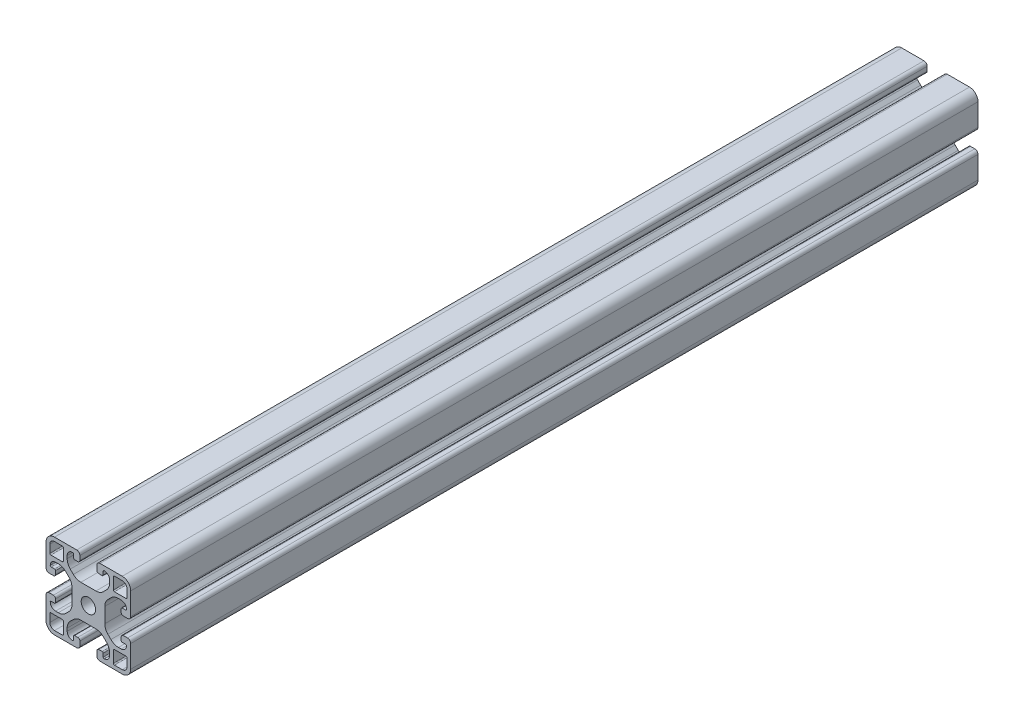
from build123d import *

# Parameters (mm, degrees)
ESQUISSE1_R        = 3.4
BOSS_EXTRU_1_DEPTH = 400


with BuildPart() as part:
    # Esquisse1 → Boss.-Extru.1 (new body)
    with BuildSketch(Plane(origin=(0, 0, -30), x_dir=(-1, 0, 0), z_dir=(0, 0, -1))):
        with BuildLine():
            Line((-4.5, 15), (-4.5, 13.5))
            ThreePointArc((-4.5, 13.5), (-4.353553391, 13.146446609), (-4, 13))
            Line((-4, 13), (-2.5, 13))
            ThreePointArc((-2.5, 13), (-2.146446609, 12.853553391), (-2, 12.5))
            ThreePointArc((-2, 12.5), (-2.732233047, 10.732233047), (-4.5, 10))
            Line((-4.5, 10), (-5.807611845, 10))
            ThreePointArc((-5.807611845, 10), (-7.721029006, 10.380602337), (-9.343145751, 11.464466094))
            Line((-9.343145751, 11.464466094), (-10.785533906, 12.906854249))
            ThreePointArc((-10.785533906, 12.906854249), (-11.869397663, 14.528970994), (-12.25, 16.442388155))
            Line((-12.25, 16.442388155), (-12.25, 23.557611845))
            ThreePointArc((-12.25, 23.557611845), (-11.869397663, 25.471029006), (-10.785533906, 27.093145751))
            Line((-10.785533906, 27.093145751), (-9.343145751, 28.535533906))
            ThreePointArc((-9.343145751, 28.535533906), (-7.721029006, 29.619397663), (-5.807611845, 30))
            Line((-5.807611845, 30), (-4.5, 30))
            ThreePointArc((-4.5, 30), (-2.732233047, 29.267766953), (-2, 27.5))
            ThreePointArc((-2, 27.5), (-2.146446609, 27.146446609), (-2.5, 27))
            Line((-2.5, 27), (-4, 27))
            ThreePointArc((-4, 27), (-4.353553391, 26.853553391), (-4.5, 26.5))
            Line((-4.5, 26.5), (-4.5, 25))
            ThreePointArc((-4.5, 25), (-4.207106781, 24.292893219), (-3.5, 24))
            Line((-3.5, 24), (-1.5, 24))
            ThreePointArc((-1.5, 24), (-0.439339828, 24.439339828), (0, 25.5))
            Line((0, 25.5), (0, 36))
            ThreePointArc((0, 36), (-1.171572875, 38.828427125), (-4, 40))
            Line((-4, 40), (-14.5, 40))
            ThreePointArc((-14.5, 40), (-15.560660172, 39.560660172), (-16, 38.5))
            Line((-16, 38.5), (-16, 36.5))
            ThreePointArc((-16, 36.5), (-15.707106781, 35.792893219), (-15, 35.5))
            Line((-15, 35.5), (-13.5, 35.5))
            ThreePointArc((-13.5, 35.5), (-13.146446609, 35.646446609), (-13, 36))
            Line((-13, 36), (-13, 37.5))
            ThreePointArc((-13, 37.5), (-12.853553391, 37.853553391), (-12.5, 38))
            ThreePointArc((-12.5, 38), (-10.732233047, 37.267766953), (-10, 35.5))
            Line((-10, 35.5), (-10, 34.192388155))
            ThreePointArc((-10, 34.192388155), (-10.380602337, 32.278970994), (-11.464466094, 30.656854249))
            Line((-11.464466094, 30.656854249), (-12.906854249, 29.214466094))
            ThreePointArc((-12.906854249, 29.214466094), (-14.528970994, 28.130602337), (-16.442388155, 27.75))
            Line((-16.442388155, 27.75), (-23.557611845, 27.75))
            ThreePointArc((-23.557611845, 27.75), (-25.471029006, 28.130602337), (-27.093145751, 29.214466094))
            Line((-27.093145751, 29.214466094), (-28.535533906, 30.656854249))
            ThreePointArc((-28.535533906, 30.656854249), (-29.619397663, 32.278970994), (-30, 34.192388155))
            Line((-30, 34.192388155), (-30, 35.5))
            ThreePointArc((-30, 35.5), (-29.267766953, 37.267766953), (-27.5, 38))
            ThreePointArc((-27.5, 38), (-27.146446609, 37.853553391), (-27, 37.5))
            Line((-27, 37.5), (-27, 36))
            ThreePointArc((-27, 36), (-26.853553391, 35.646446609), (-26.5, 35.5))
            Line((-26.5, 35.5), (-25, 35.5))
            ThreePointArc((-25, 35.5), (-24.292893219, 35.792893219), (-24, 36.5))
            Line((-24, 36.5), (-24, 38.5))
            ThreePointArc((-24, 38.5), (-24.439339828, 39.560660172), (-25.5, 40))
            Line((-25.5, 40), (-36, 40))
            ThreePointArc((-36, 40), (-38.828427125, 38.828427125), (-40, 36))
            Line((-40, 36), (-40, 25.5))
            ThreePointArc((-40, 25.5), (-39.560660172, 24.439339828), (-38.5, 24))
            Line((-38.5, 24), (-36.5, 24))
            ThreePointArc((-36.5, 24), (-35.792893219, 24.292893219), (-35.5, 25))
            Line((-35.5, 25), (-35.5, 26.5))
            ThreePointArc((-35.5, 26.5), (-35.646446609, 26.853553391), (-36, 27))
            Line((-36, 27), (-37.5, 27))
            ThreePointArc((-37.5, 27), (-37.853553391, 27.146446609), (-38, 27.5))
            ThreePointArc((-38, 27.5), (-37.267766953, 29.267766953), (-35.5, 30))
            Line((-35.5, 30), (-34.192388155, 30))
            ThreePointArc((-34.192388155, 30), (-32.278970994, 29.619397663), (-30.656854249, 28.535533906))
            Line((-30.656854249, 28.535533906), (-29.214466094, 27.093145751))
            ThreePointArc((-29.214466094, 27.093145751), (-28.130602337, 25.471029006), (-27.75, 23.557611845))
            Line((-27.75, 23.557611845), (-27.75, 16.442388155))
            ThreePointArc((-27.75, 16.442388155), (-28.130602337, 14.528970994), (-29.214466094, 12.906854249))
            Line((-29.214466094, 12.906854249), (-30.656854249, 11.464466094))
            ThreePointArc((-30.656854249, 11.464466094), (-32.278970994, 10.380602337), (-34.192388155, 10))
            Line((-34.192388155, 10), (-35.5, 10))
            ThreePointArc((-35.5, 10), (-37.267766953, 10.732233047), (-38, 12.5))
            ThreePointArc((-38, 12.5), (-37.853553391, 12.853553391), (-37.5, 13))
            Line((-37.5, 13), (-36, 13))
            ThreePointArc((-36, 13), (-35.646446609, 13.146446609), (-35.5, 13.5))
            Line((-35.5, 13.5), (-35.5, 15))
            ThreePointArc((-35.5, 15), (-35.792893219, 15.707106781), (-36.5, 16))
            Line((-36.5, 16), (-38.5, 16))
            ThreePointArc((-38.5, 16), (-39.560660172, 15.560660172), (-40, 14.5))
            Line((-40, 14.5), (-40, 4))
            ThreePointArc((-40, 4), (-38.828427125, 1.171572875), (-36, 0))
            Line((-36, 0), (-25.5, 0))
            ThreePointArc((-25.5, 0), (-24.439339828, 0.439339828), (-24, 1.5))
            Line((-24, 1.5), (-24, 3.5))
            ThreePointArc((-24, 3.5), (-24.292893219, 4.207106781), (-25, 4.5))
            Line((-25, 4.5), (-26.5, 4.5))
            ThreePointArc((-26.5, 4.5), (-26.853553391, 4.353553391), (-27, 4))
            Line((-27, 4), (-27, 2.5))
            ThreePointArc((-27, 2.5), (-27.146446609, 2.146446609), (-27.5, 2))
            ThreePointArc((-27.5, 2), (-29.267766953, 2.732233047), (-30, 4.5))
            Line((-30, 4.5), (-30, 5.807611845))
            ThreePointArc((-30, 5.807611845), (-29.619397663, 7.721029006), (-28.535533906, 9.343145751))
            Line((-28.535533906, 9.343145751), (-27.093145751, 10.785533906))
            ThreePointArc((-27.093145751, 10.785533906), (-25.471029006, 11.869397663), (-23.557611845, 12.25))
            Line((-23.557611845, 12.25), (-16.442388155, 12.25))
            ThreePointArc((-16.442388155, 12.25), (-14.528970994, 11.869397663), (-12.906854249, 10.785533906))
            Line((-12.906854249, 10.785533906), (-11.464466094, 9.343145751))
            ThreePointArc((-11.464466094, 9.343145751), (-10.380602337, 7.721029006), (-10, 5.807611845))
            Line((-10, 5.807611845), (-10, 4.5))
            ThreePointArc((-10, 4.5), (-10.732233047, 2.732233047), (-12.5, 2))
            ThreePointArc((-12.5, 2), (-12.853553391, 2.146446609), (-13, 2.5))
            Line((-13, 2.5), (-13, 4))
            ThreePointArc((-13, 4), (-13.146446609, 4.353553391), (-13.5, 4.5))
            Line((-13.5, 4.5), (-15, 4.5))
            ThreePointArc((-15, 4.5), (-15.707106781, 4.207106781), (-16, 3.5))
            Line((-16, 3.5), (-16, 1.5))
            ThreePointArc((-16, 1.5), (-15.560660172, 0.439339828), (-14.5, 0))
            Line((-14.5, 0), (-4, 0))
            ThreePointArc((-4, 0), (-1.171572875, 1.171572875), (0, 4))
            Line((0, 4), (0, 14.5))
            ThreePointArc((0, 14.5), (-0.439339828, 15.560660172), (-1.5, 16))
            Line((-1.5, 16), (-3.5, 16))
            ThreePointArc((-3.5, 16), (-4.207106781, 15.707106781), (-4.5, 15))
        make_face()
        with Locations(Location((-20, 20, 0), (0, 0, 180))):
            Circle(ESQUISSE1_R, mode=Mode.SUBTRACT)
        with BuildLine():
            Line((-4, 1.8), (-7.7, 1.8))
            ThreePointArc((-7.7, 1.8), (-8.053553391, 1.946446609), (-8.2, 2.3))
            Line((-8.2, 2.3), (-8.2, 7.7))
            ThreePointArc((-8.2, 7.7), (-8.053553391, 8.053553391), (-7.7, 8.2))
            Line((-7.7, 8.2), (-2.3, 8.2))
            ThreePointArc((-2.3, 8.2), (-1.946446609, 8.053553391), (-1.8, 7.7))
            Line((-1.8, 7.7), (-1.8, 4))
            ThreePointArc((-1.8, 4), (-2.444365081, 2.444365081), (-4, 1.8))
        make_face(mode=Mode.SUBTRACT)
        with BuildLine():
            Line((-38.2, 4), (-38.2, 7.7))
            ThreePointArc((-38.2, 7.7), (-38.053553391, 8.053553391), (-37.7, 8.2))
            Line((-37.7, 8.2), (-32.3, 8.2))
            ThreePointArc((-32.3, 8.2), (-31.946446609, 8.053553391), (-31.8, 7.7))
            Line((-31.8, 7.7), (-31.8, 2.3))
            ThreePointArc((-31.8, 2.3), (-31.946446609, 1.946446609), (-32.3, 1.8))
            Line((-32.3, 1.8), (-36, 1.8))
            ThreePointArc((-36, 1.8), (-37.555634919, 2.444365081), (-38.2, 4))
        make_face(mode=Mode.SUBTRACT)
        with BuildLine():
            Line((-36, 38.2), (-32.3, 38.2))
            ThreePointArc((-32.3, 38.2), (-31.946446609, 38.053553391), (-31.8, 37.7))
            Line((-31.8, 37.7), (-31.8, 32.3))
            ThreePointArc((-31.8, 32.3), (-31.946446609, 31.946446609), (-32.3, 31.8))
            Line((-32.3, 31.8), (-37.7, 31.8))
            ThreePointArc((-37.7, 31.8), (-38.053553391, 31.946446609), (-38.2, 32.3))
            Line((-38.2, 32.3), (-38.2, 36))
            ThreePointArc((-38.2, 36), (-37.555634919, 37.555634919), (-36, 38.2))
        make_face(mode=Mode.SUBTRACT)
        with BuildLine():
            Line((-1.8, 36), (-1.8, 32.3))
            ThreePointArc((-1.8, 32.3), (-1.946446609, 31.946446609), (-2.3, 31.8))
            Line((-2.3, 31.8), (-7.7, 31.8))
            ThreePointArc((-7.7, 31.8), (-8.053553391, 31.946446609), (-8.2, 32.3))
            Line((-8.2, 32.3), (-8.2, 37.7))
            ThreePointArc((-8.2, 37.7), (-8.053553391, 38.053553391), (-7.7, 38.2))
            Line((-7.7, 38.2), (-4, 38.2))
            ThreePointArc((-4, 38.2), (-2.444365081, 37.555634919), (-1.8, 36))
        make_face(mode=Mode.SUBTRACT)
    extrude(amount=-BOSS_EXTRU_1_DEPTH)


solid = part.part
